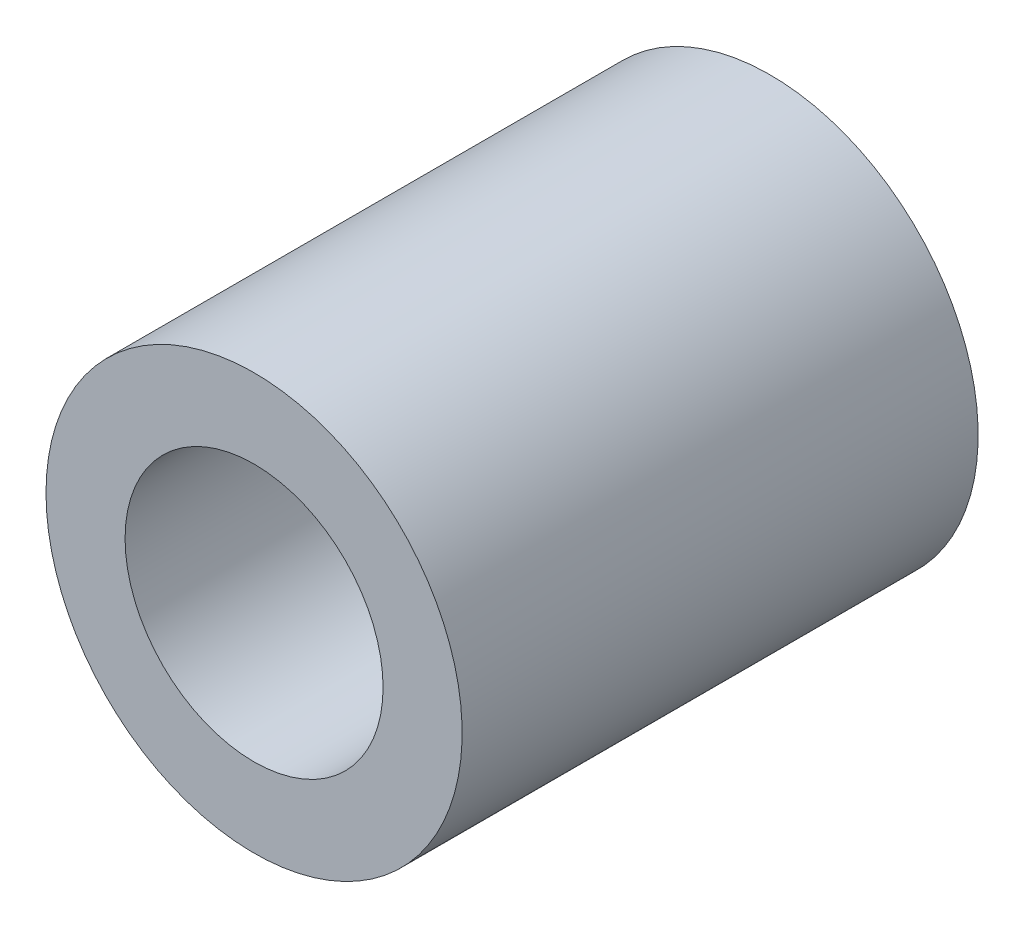
from build123d import *

# Parameters (mm, degrees)
SKETCH1_R           = 2.5
SKETCH1_R_2         = 1.55
BOSS_EXTRUDE1_DEPTH = 6.2


with BuildPart() as part:
    # Sketch1 → Boss-Extrude1 (new body)
    with BuildSketch(Plane.XY):
        with Locations(Location((0, 0, 0), (0, 0, 180))):
            Circle(SKETCH1_R)
        with Locations(Location((0, 0, 0), (0, 0, 180))):
            Circle(SKETCH1_R_2, mode=Mode.SUBTRACT)
    extrude(amount=BOSS_EXTRUDE1_DEPTH)


solid = part.part
